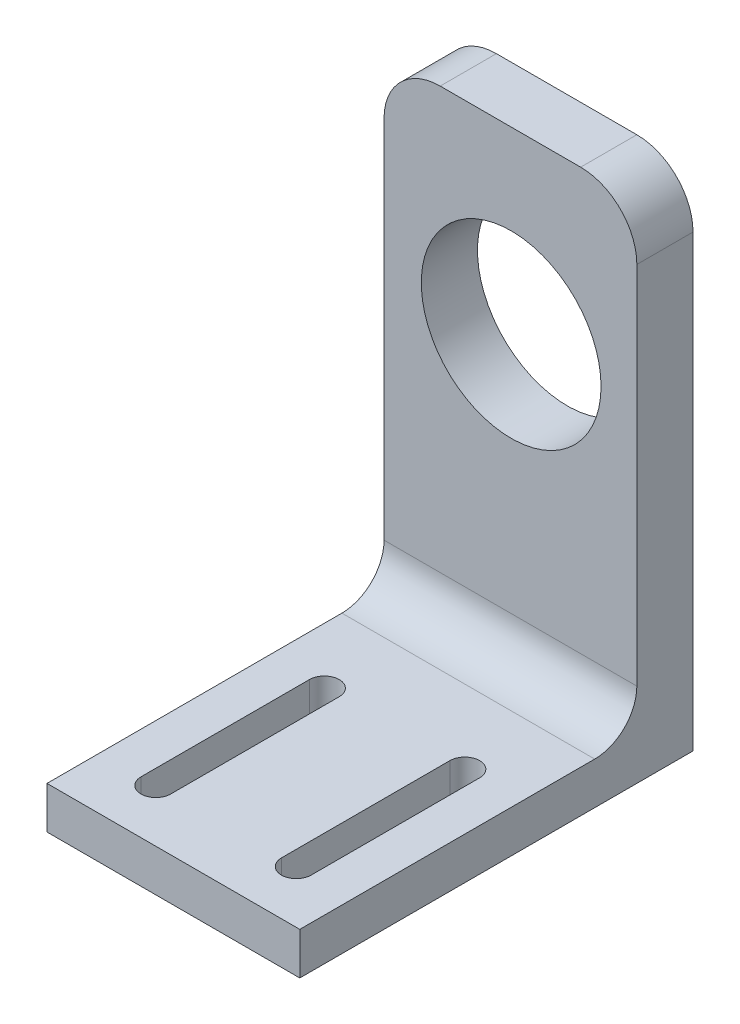
from build123d import *

# Parameters (mm, degrees)
SKETCH1_W           = 45
SKETCH1_H           = 90
BOSS_EXTRUDE1_DEPTH = 10
SKETCH2_R           = 16
CUT_EXTRUDE1_DEPTH  = 28
FILLET1_R           = 10
SKETCH3_W           = 45
SKETCH3_H           = 7.5
BOSS_EXTRUDE2_DEPTH = 60
FILLET2_R           = 7.5
CUT_EXTRUDE2_DEPTH  = 10


with BuildPart() as part:
    # Sketch1 → Boss-Extrude1 (new body)
    with BuildSketch(Plane.XY):
        Rectangle(SKETCH1_W, SKETCH1_H)
    extrude(amount=BOSS_EXTRUDE1_DEPTH)

    # Sketch2 → Cut-Extrude1 (cut)
    with BuildSketch(Plane.XY):
        with Locations((0.129474069, 13.005480981)):
            Circle(SKETCH2_R)
    extrude(amount=CUT_EXTRUDE1_DEPTH, mode=Mode.SUBTRACT)

    # Fillet1
    fillet1_edges = [part.edges().sort_by_distance(p)[0] for p in [
        (-22.5, 45, 5),
        (22.5, 45, 5),
    ]]
    fillet(fillet1_edges, radius=FILLET1_R)

    # Sketch3 → Boss-Extrude2 (add)
    with BuildSketch(Plane.XY.offset(10)):
        with Locations((0, -41.25)):
            Rectangle(SKETCH3_W, SKETCH3_H)
    extrude(amount=BOSS_EXTRUDE2_DEPTH)

    # Fillet2
    fillet2_edges = [part.edges().sort_by_distance(p)[0] for p in [
        (0, -37.5, 10),
    ]]
    fillet(fillet2_edges, radius=FILLET2_R)

    # Sketch4 → Cut-Extrude2 (cut)
    with BuildSketch(Plane(origin=(0, -37.5, 0), x_dir=(1, 0, 0), z_dir=(0, 1, 0))):
        with BuildLine():
            Line((-9.85, -30.625), (-9.85, -60.625))
            ThreePointArc((-9.85, -60.625), (-12.5, -63.275), (-15.15, -60.625))
            Line((-15.15, -60.625), (-15.15, -30.625))
            ThreePointArc((-15.15, -30.625), (-12.5, -27.975), (-9.85, -30.625))
        make_face()
        with BuildLine():
            Line((9.85, -30.625), (9.85, -60.625))
            ThreePointArc((9.85, -60.625), (12.5, -63.275), (15.15, -60.625))
            Line((15.15, -60.625), (15.15, -30.625))
            ThreePointArc((15.15, -30.625), (12.5, -27.975), (9.85, -30.625))
        make_face()
    extrude(amount=-CUT_EXTRUDE2_DEPTH, mode=Mode.SUBTRACT)


solid = part.part
